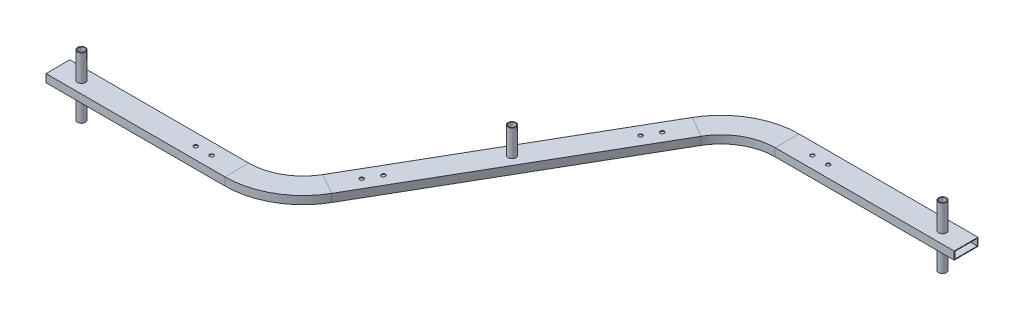
from build123d import *

# Parameters (mm, degrees)
SKETCH_2_W          = 180
SKETCH_2_H          = 60
SKETCH_2_W_2        = 170
SKETCH_2_H_2        = 50
SKETCH_3_R          = 15
CUT_EXTRUDE_1_DEPTH = 2600.631218289
SKETCH_4_R          = 30
SKETCH_4_R_2        = 25
EXTRUDE_2_DEPTH     = 200
EXTRUDE_START       = 200
SKETCH_5_R          = 30
SKETCH_5_R_2        = 25
EXTRUDE_3_DEPTH     = 200


with BuildPart() as part:
    # 扫描1: sweep along a path in 草图1
    with BuildLine(Plane(origin=(0, 0, 0), x_dir=(1, 0, 0), z_dir=(0, 1, 0))) as sweep_1_path:
        Line((-2293.012701892, -1133.34591186), (-943.012701892, -1133.34591186))
        ThreePointArc((-943.012701892, -1133.34591186), (-693.012701892, -1066.358613752), (-510, -883.34591186))
        Line((-510, -883.34591186), (510, 883.34591186))
        ThreePointArc((510, 883.34591186), (693.012701892, 1066.358613752), (943.012701892, 1133.34591186))
        Line((943.012701892, 1133.34591186), (2293.012701892, 1133.34591186))
    # 草图2 → 扫描1 (sweep)
    with BuildSketch(Plane(origin=(-2293.012701892, 0, 1133.34591186), x_dir=(0, 0, -1), z_dir=(1, 0, 0))):
        Rectangle(SKETCH_2_W, SKETCH_2_H)
        Rectangle(SKETCH_2_W_2, SKETCH_2_H_2, mode=Mode.SUBTRACT)
    sweep(path=sweep_1_path.line)

    # 草图3 → 切除-拉伸1 (cut, through all)
    with BuildSketch(Plane(origin=(0, 30, 0), x_dir=(1, 0, 0), z_dir=(0, 1, 0))):
        with Locations(Location((-1253.012701892, -1133.34591186, 0), (0, 0, 270))):
            Circle(SKETCH_3_R)
        with Locations(Location((-1133.012701892, -1133.34591186, 0), (0, 0, 270))):
            Circle(SKETCH_3_R)
        with Locations(Location((-415, -718.801085141, 0), (0, 0, 270))):
            Circle(SKETCH_3_R)
        with Locations(Location((-355, -614.878036687, 0), (0, 0, 270))):
            Circle(SKETCH_3_R)
        with Locations(Location((1253.012701892, 1133.34591186, 0), (0, 0, 270))):
            Circle(SKETCH_3_R)
        with Locations(Location((1133.012701892, 1133.34591186, 0), (0, 0, 270))):
            Circle(SKETCH_3_R)
        with Locations(Location((415, 718.801085141, 0), (0, 0, 270))):
            Circle(SKETCH_3_R)
        with Locations(Location((355, 614.878036687, 0), (0, 0, 270))):
            Circle(SKETCH_3_R)
    extrude(amount=-CUT_EXTRUDE_1_DEPTH, mode=Mode.SUBTRACT)

    # 草图4 → 凸台-拉伸2 (add)
    # profile 1 of 3: a face of its own
    with BuildSketch(Plane(origin=(0, 30, 0), x_dir=(1, 0, 0), z_dir=(0, 1, 0))):
        with Locations(Location((0, 0, 0), (0, 0, 270))):
            Circle(SKETCH_4_R)
        with Locations(Location((0, 0, 0), (0, 0, 270))):
            Circle(SKETCH_4_R_2, mode=Mode.SUBTRACT)
    # profile 2 of 3: a face of its own
    with BuildSketch(Plane(origin=(0, 30, 0), x_dir=(1, 0, 0), z_dir=(0, 1, 0))):
        with Locations(Location((-2115.544148457, -1133.34591186, 0), (0, 0, 270))):
            Circle(SKETCH_4_R)
        with Locations(Location((-2115.544148457, -1133.34591186, 0), (0, 0, 270))):
            Circle(SKETCH_4_R_2, mode=Mode.SUBTRACT)
    # profile 3 of 3: a face of its own
    with BuildSketch(Plane(origin=(0, 30, 0), x_dir=(1, 0, 0), z_dir=(0, 1, 0))):
        with Locations(Location((2115.544148457, 1133.34591186, 0), (0, 0, 270))):
            Circle(SKETCH_4_R)
        with Locations(Location((2115.544148457, 1133.34591186, 0), (0, 0, 270))):
            Circle(SKETCH_4_R_2, mode=Mode.SUBTRACT)
    extrude(amount=EXTRUDE_2_DEPTH)

    # 草图5 → 凸台-拉伸3 (add)
    # profile 1 of 2: a face of its own
    with BuildSketch(Plane.XZ.offset(30).offset(EXTRUDE_START)):
        with Locations(Location((-2115.544148457, 1133.34591186, 0), (0, 0, 90))):
            Circle(SKETCH_5_R)
        with Locations(Location((-2115.544148457, 1133.34591186, 0), (0, 0, 90))):
            Circle(SKETCH_5_R_2, mode=Mode.SUBTRACT)
    # profile 2 of 2: a face of its own
    with BuildSketch(Plane.XZ.offset(30).offset(EXTRUDE_START)):
        with Locations(Location((2115.544148457, -1133.34591186, 0), (0, 0, 90))):
            Circle(SKETCH_5_R)
        with Locations(Location((2115.544148457, -1133.34591186, 0), (0, 0, 90))):
            Circle(SKETCH_5_R_2, mode=Mode.SUBTRACT)
    extrude(amount=-EXTRUDE_3_DEPTH)


solid = part.part
